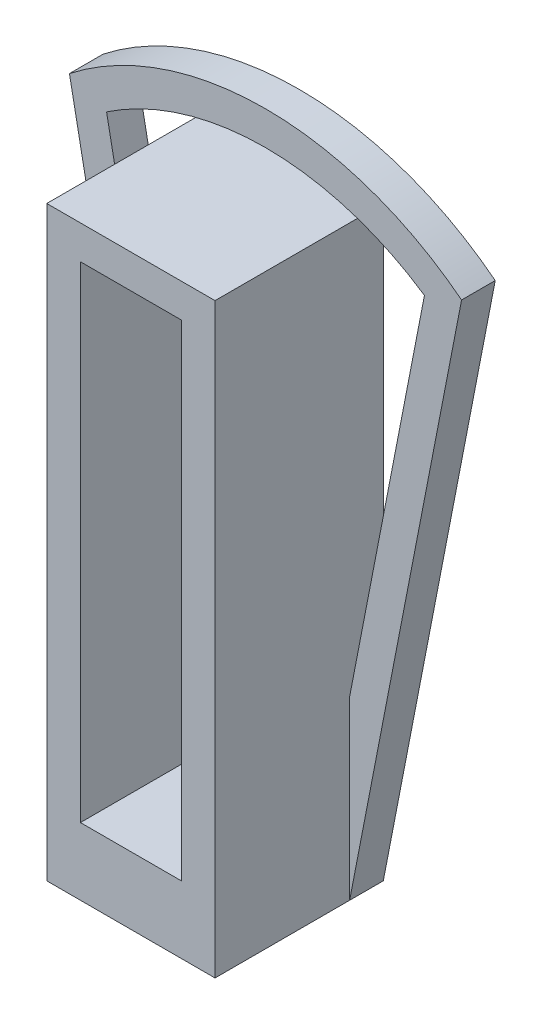
from build123d import *

# Parameters (mm, degrees)
BOSS_EXTRUDE1_DEPTH = 0.2
BOSS_EXTRUDE2_DEPTH = 0.2
SKETCH4_W           = 1
SKETCH4_H           = 3.486416791
SKETCH4_W_2         = 0.6
SKETCH4_H_2         = 2.886416791
BOSS_EXTRUDE3_DEPTH = 1


with BuildPart() as part:
    # Sketch1 → Boss-Extrude1 (new body)
    with BuildSketch(Plane.XY):
        with BuildLine():
            Line((-0.5, -1.7), (-1.165239685, 1.722361495))
            ThreePointArc((-1.165239685, 1.722361495), (0, 2.123983376), (1.165239685, 1.722361495))
            Line((1.165239685, 1.722361495), (0.5, -1.7))
            Line((0.5, -1.7), (-0.5, -1.7))
        make_face()
        with BuildLine():
            Line((-0.335132723, -1.5), (-0.944627099, 1.635576741))
            ThreePointArc((-0.944627099, 1.635576741), (0, 1.923983376), (0.944627099, 1.635576741))
            Line((0.944627099, 1.635576741), (0.335132723, -1.5))
            Line((0.335132723, -1.5), (-0.335132723, -1.5))
        make_face(mode=Mode.SUBTRACT)
    extrude(amount=BOSS_EXTRUDE1_DEPTH)

    # Sketch3 → Boss-Extrude2 (add)
    with BuildSketch(Plane.XY.offset(0.2)):
        Polygon((-0.374008785, -1.3), (0.374008785, -1.3), (0.335132723, -1.5), (-0.335132723, -1.5), align=None)
    extrude(amount=-BOSS_EXTRUDE2_DEPTH)


with BuildPart() as body_2:
    # Sketch4 → Boss-Extrude3 (new body)
    with BuildSketch(Plane.XY):
        with Locations((0, 0.043208395)):
            Rectangle(SKETCH4_W, SKETCH4_H)
        with Locations((0, 0.143208395)):
            Rectangle(SKETCH4_W_2, SKETCH4_H_2, mode=Mode.SUBTRACT)
    extrude(amount=BOSS_EXTRUDE3_DEPTH)


solid = Compound([part.part, body_2.part])
